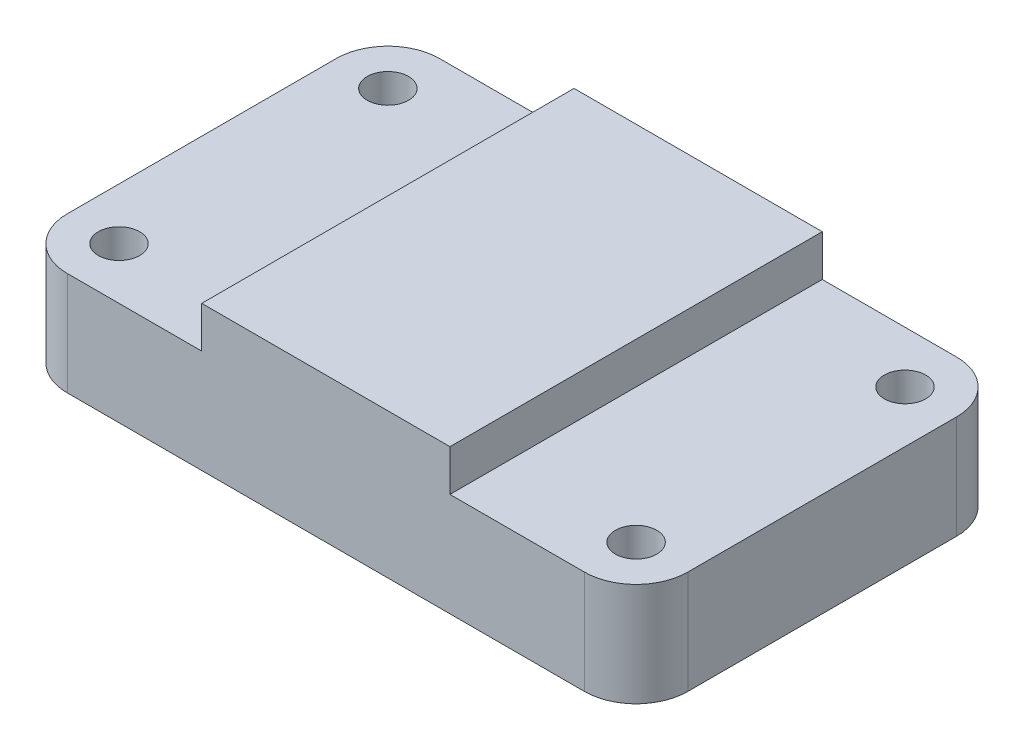
from build123d import *

# Parameters (mm, degrees)
ESQUISSE1_R          = 10
BOSS_EXTRU_1_DEPTH   = 50
BOSS_EXTRU_1_2_DEPTH = 50
ESQUISSE1_3_W        = 120
ESQUISSE1_3_H        = 180
BOSS_EXTRU_2_DEPTH   = 70


with BuildPart() as part:
    # Esquisse1 → Boss.-Extru.1 (new body)
    with BuildSketch(Plane(origin=(0, 0, 0), x_dir=(1, 0, 0), z_dir=(0, 1, 0))):
        with BuildLine():
            Line((-60, -90), (-60, 90))
            Line((-60, 90), (-125, 90))
            ThreePointArc((-125, 90), (-142.67766953, 82.67766953), (-150, 65))
            Line((-150, 65), (-150, -65))
            ThreePointArc((-150, -65), (-142.67766953, -82.67766953), (-125, -90))
            Line((-125, -90), (-60, -90))
        make_face()
        with Locations((-125, -65)):
            Circle(ESQUISSE1_R, mode=Mode.SUBTRACT)
        with Locations((-125, 65)):
            Circle(ESQUISSE1_R, mode=Mode.SUBTRACT)
    extrude(amount=BOSS_EXTRU_1_DEPTH)



with BuildPart() as body_2:
    # Esquisse1 → Boss.-Extru.1 2 (new body)
    with BuildSketch(Plane(origin=(0, 0, 0), x_dir=(1, 0, 0), z_dir=(0, 1, 0))):
        with BuildLine():
            Line((125, 90), (60, 90))
            Line((60, 90), (60, -90))
            Line((60, -90), (125, -90))
            ThreePointArc((125, -90), (142.67766953, -82.67766953), (150, -65))
            Line((150, -65), (150, 65))
            ThreePointArc((150, 65), (142.67766953, 82.67766953), (125, 90))
        make_face()
        with Locations((125, -65)):
            Circle(ESQUISSE1_R, mode=Mode.SUBTRACT)
        with Locations((125, 65)):
            Circle(ESQUISSE1_R, mode=Mode.SUBTRACT)
    extrude(amount=BOSS_EXTRU_1_2_DEPTH)


with BuildPart() as part_1:
    add(part.part)

    add(body_2.part)  # Boss.-Extru.2 merges body 2
    # Esquisse1<3> → Boss.-Extru.2 (add)
    with BuildSketch(Plane(origin=(0, 0, 0), x_dir=(1, 0, 0), z_dir=(0, 1, 0))):
        Rectangle(ESQUISSE1_3_W, ESQUISSE1_3_H)
    extrude(amount=BOSS_EXTRU_2_DEPTH)


solid = part_1.part
